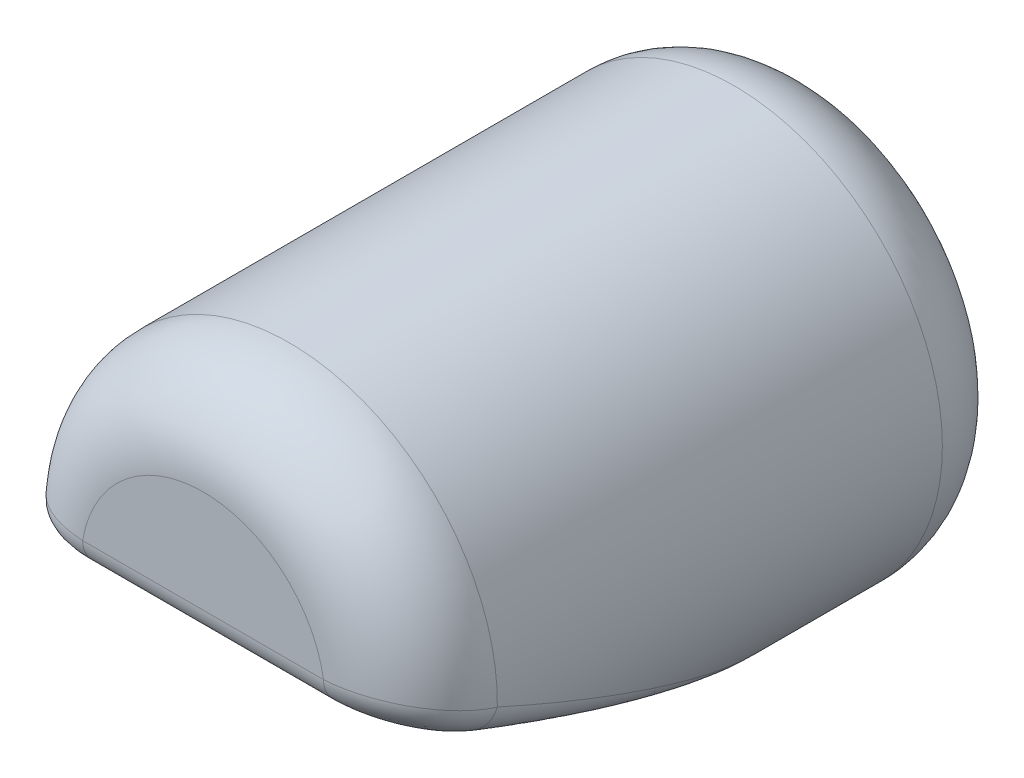
from build123d import *
from build123d.topology import SkipClean

# Parameters (mm, degrees)
SKETCH2_R               = 7.25
BOSS_EXTRUDE1_DEPTH     = 21.5
FILLET1_R               = 3
CUT_EXTRUDE1_DEPTH      = 10
CUT_EXTRUDE1_DEPTH_BACK = 10
FILLET2_R               = 1


with BuildPart() as part:
    # Sketch2 → Boss-Extrude1 (new body)
    with BuildSketch(Plane.XY):
        Circle(SKETCH2_R)
    extrude(amount=BOSS_EXTRUDE1_DEPTH)

    # Fillet1
    fillet1_edges = [part.edges().sort_by_distance(p)[0] for p in [
        (-7.25, 0, 21.5),
        (-7.25, 0, 0),
    ]]
    fillet(fillet1_edges, radius=FILLET1_R)

    # Sketch3 → Cut-Extrude1 (cut, two sides: drawn at the far end of the back side and taken through both)
    with SkipClean():  # the faces are left unmerged after this step: merging them gives an invalid solid
        with BuildSketch(Plane(origin=(0, 0, 0), x_dir=(0, 0, -1), z_dir=(1, 0, 0)).offset(-CUT_EXTRUDE1_DEPTH_BACK)):
            Polygon((-21.5, 0), (-3, -7.25), (-3, -10.4048104), (-21.5, -10.4048104), align=None)
        extrude(amount=CUT_EXTRUDE1_DEPTH + CUT_EXTRUDE1_DEPTH_BACK, mode=Mode.SUBTRACT)

    # Fillet2
    fillet2_edges = [part.edges().sort_by_distance(p)[0] for p in [
        (5.577786863, -4.631500158, 9.681689251),
        (6.394161679, -0.357412535, 20.587981808),
        (-5.577786862, -4.631500159, 9.68168925),
        (-6.394161651, -0.357412523, 20.587981837),
        (0, 0, 21.5),
    ]]
    fillet(fillet2_edges, radius=FILLET2_R)


solid = part.part
